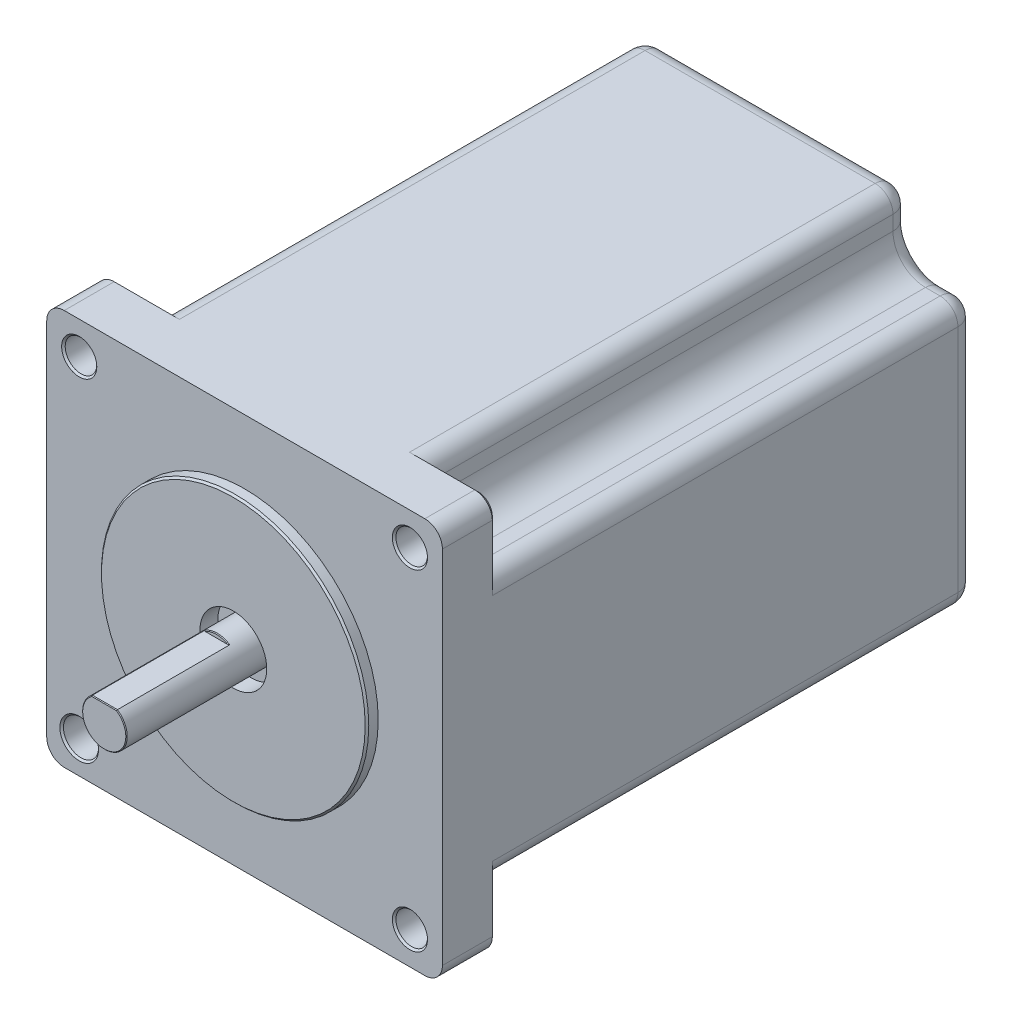
from build123d import *

# Parameters (mm, degrees)
EXTRUDE1_DEPTH      = 7.62
SKETCH2_R           = 2.25
EXTRUDE2_DEPTH      = 7.62
SKETCH3_R           = 2.25
SKETCH3_R_2         = 2.5
EXTRUDE3_DEPTH      = 7.62
SKETCH5_R           = 19.05
EXTRUDE5_DEPTH      = 9.222
EXTRUDE7_DEPTH      = 68.4
FILLET1_R           = 2.54
CHAMFER1_SIZE       = 0.508
CHAMFER2_SIZE       = 0.508
SKETCH8_R           = 5.835393935
EXTRUDE9_DEPTH      = 2.54
CHAMFER6_SIZE       = 0.254
CHAMFER7_SIZE       = 0.508
CHAMFER8_SIZE       = 0.508
SKETCH9_R           = 4.7625
CUT_EXTRUDE1_DEPTH  = 2.54
SKETCH10_R          = 3.175
BOSS_EXTRUDE1_DEPTH = 20.94
BOSS_EXTRUDE2_START = 17.538
SKETCH11_R          = 3.175
BOSS_EXTRUDE2_DEPTH = 17.538
CHAMFER9_SIZE       = 0.254
CHAMFER10_SIZE      = 0.254
CHAMFER11_SIZE      = 0.254
SKETCH12_W          = 8.536855061
SKETCH12_H          = 3.479171119
CUT_EXTRUDE2_DEPTH  = 16
CHAMFER12_SIZE      = 0.1
SKETCH13_W          = 12.128390522
SKETCH13_H          = 4.389322284
CUT_EXTRUDE3_DEPTH  = 14
CHAMFER13_SIZE      = 0.1


with BuildPart() as part:
    # Sketch1 → Extrude1 (new body)
    with BuildSketch(Plane.XY):
        with BuildLine():
            Line((25.7, -28.2), (-25.7, -28.2))
            ThreePointArc((-25.7, -28.2), (-27.467766953, -27.467766953), (-28.2, -25.7))
            Line((-28.2, -25.7), (-28.2, 25.7))
            ThreePointArc((-28.2, 25.7), (-27.467766953, 27.467766953), (-25.7, 28.2))
            Line((-25.7, 28.2), (25.7, 28.2))
            ThreePointArc((25.7, 28.2), (27.467766953, 27.467766953), (28.2, 25.7))
            Line((28.2, 25.7), (28.2, -25.7))
            ThreePointArc((28.2, -25.7), (27.467766953, -27.467766953), (25.7, -28.2))
        make_face()
    extrude(amount=EXTRUDE1_DEPTH)

    # Sketch2 → Extrude2 (cut)
    with BuildSketch(Plane.XY.offset(7.62)):
        with Locations((-23.569999999, 23.57)):
            Circle(SKETCH2_R)
    extrude(amount=-EXTRUDE2_DEPTH, mode=Mode.SUBTRACT)

    # Sketch3 → Extrude3 (cut)
    with BuildSketch(Plane.XY.offset(7.62)):
        with Locations((23.569999999, 23.57)):
            Circle(SKETCH3_R)
        with Locations((23.569999999, -23.57)):
            Circle(SKETCH3_R)
        with Locations((-23.57, -23.57)):
            Circle(SKETCH3_R_2)
    extrude(amount=-EXTRUDE3_DEPTH, mode=Mode.SUBTRACT)

    # Sketch5 → Extrude5 (add)
    with BuildSketch(Plane.XY):
        Circle(SKETCH5_R)
    extrude(amount=EXTRUDE5_DEPTH)

    # Sketch6 → Extrude7 (add)
    with BuildSketch(Plane.XY):
        with BuildLine():
            Line((-18.94, 28.2), (-18.94, 23.57))
            ThreePointArc((-18.94, 23.57), (-20.296095603, 20.296095603), (-23.57, 18.94))
            Line((-23.57, 18.94), (-28.2, 18.94))
            Line((-28.2, 18.94), (-28.2, -18.939999999))
            Line((-28.2, -18.939999999), (-23.57, -18.939999999))
            ThreePointArc((-23.57, -18.939999999), (-20.296095603, -20.296095602), (-18.94, -23.569999999))
            Line((-18.94, -23.569999999), (-18.94, -28.2))
            Line((-18.94, -28.2), (-5.065990887, -28.2))
            Line((-5.065990887, -28.2), (5.065990887, -28.2))
            Line((5.065990887, -28.2), (18.939999999, -28.2))
            Line((18.939999999, -28.2), (18.939999999, -23.569999999))
            ThreePointArc((18.939999999, -23.569999999), (20.296095602, -20.296095602), (23.569999999, -18.939999999))
            Line((23.569999999, -18.939999999), (28.2, -18.939999999))
            Line((28.2, -18.939999999), (28.2, 18.94))
            Line((28.2, 18.94), (23.57, 18.94))
            ThreePointArc((23.57, 18.94), (20.296095602, 20.296095603), (18.939999999, 23.57))
            Line((18.939999999, 23.57), (18.939999999, 28.2))
            Line((18.939999999, 28.2), (-18.94, 28.2))
        make_face()
    extrude(amount=-EXTRUDE7_DEPTH)

    # Fillet1
    fillet1_edges = [part.edges().sort_by_distance(p)[0] for p in [
        (20.296095602, 20.296095603, -68.4),
        (18.939999999, 25.885, -68.4),
        (-1e-09, 28.2, -68.4),
        (-18.94, 25.885, -68.4),
        (-20.296095603, 20.296095603, -68.4),
        (-25.885, 18.94, -68.4),
        (-28.2, 0, -68.4),
        (-25.885, -18.939999999, -68.4),
        (-20.296095603, -20.296095602, -68.4),
        (-18.94, -25.885, -68.4),
        (-1e-09, -28.2, -68.4),
        (18.939999999, -25.885, -68.4),
        (20.296095602, -20.296095602, -68.4),
        (25.885, -18.939999999, -68.4),
        (28.2, 0, -68.4),
        (25.885, 18.94, -68.4),
        (18.939999999, -28.2, -34.2),
        (28.2, -18.939999999, -34.2),
        (-18.94, -28.2, -34.2),
        (-28.2, -18.939999999, -34.2),
        (28.2, 18.94, -34.2),
        (18.939999999, 28.2, -34.2),
        (-18.94, 28.2, -34.2),
        (-28.2, 18.94, -34.2),
    ]]
    fillet(fillet1_edges, radius=FILLET1_R)

    # Chamfer1
    chamfer1_edges = [part.edges().sort_by_distance(p)[0] for p in [
        (21.049999999, 28.2, 0),
        (27.467766953, 27.467766953, 0),
        (28.2, 21.05, 0),
    ]]
    chamfer(chamfer1_edges, length=CHAMFER1_SIZE)

    # Chamfer2
    chamfer2_edges = [part.edges().sort_by_distance(p)[0] for p in [
        (-28.2, -21.049999999, 0),
        (-21.05, -28.2, 0),
        (-27.467766953, -27.467766953, 0),
    ]]
    chamfer(chamfer2_edges, length=CHAMFER2_SIZE)

    # Sketch8 → Extrude9 (cut)
    with BuildSketch(Plane(origin=(0, 0, -68.4), x_dir=(-1, 0, 0), z_dir=(0, 0, -1))):
        Circle(SKETCH8_R)
    extrude(amount=-EXTRUDE9_DEPTH, mode=Mode.SUBTRACT)

    # Chamfer6
    chamfer6_edges = [part.edges().sort_by_distance(p)[0] for p in [
        (5.835393935, 0, -68.4),
    ]]
    chamfer(chamfer6_edges, length=CHAMFER6_SIZE)

    # Chamfer7
    chamfer7_edges = [part.edges().sort_by_distance(p)[0] for p in [
        (28.2, -21.049999999, 0),
        (27.467766953, -27.467766953, 0),
        (21.049999999, -28.2, 0),
    ]]
    chamfer(chamfer7_edges, length=CHAMFER7_SIZE)

    # Chamfer8
    chamfer8_edges = [part.edges().sort_by_distance(p)[0] for p in [
        (-27.467766953, 27.467766953, 0),
        (-28.2, 21.05, 0),
        (-21.05, 28.2, 0),
    ]]
    chamfer(chamfer8_edges, length=CHAMFER8_SIZE)

    # Sketch9 → Cut-Extrude1 (cut)
    with BuildSketch(Plane.XY.offset(9.222)):
        Circle(SKETCH9_R)
    extrude(amount=-CUT_EXTRUDE1_DEPTH, mode=Mode.SUBTRACT)

    # Sketch10 → Boss-Extrude1 (add)
    with BuildSketch(Plane.XY.offset(6.682)):
        Circle(SKETCH10_R)
    extrude(amount=BOSS_EXTRUDE1_DEPTH)

    # Sketch11 → Boss-Extrude2 (add)
    with BuildSketch(Plane(origin=(0, 0, -65.86), x_dir=(-1, 0, 0), z_dir=(0, 0, -1)).offset(BOSS_EXTRUDE2_START)):
        with Locations(Location((0, 0, 0), (0, 0, 180))):
            Circle(SKETCH11_R)
    extrude(amount=-BOSS_EXTRUDE2_DEPTH)

    # Chamfer9
    chamfer9_edges = [part.edges().sort_by_distance(p)[0] for p in [
        (-19.05, 0, 9.222),
    ]]
    chamfer(chamfer9_edges, length=CHAMFER9_SIZE)

    # Chamfer10
    chamfer10_edges = [part.edges().sort_by_distance(p)[0] for p in [
        (-25.819999999, 23.57, 7.62),
        (21.319999999, 23.57, 7.62),
        (-26.07, -23.57, 7.62),
        (21.319999999, -23.57, 7.62),
    ]]
    chamfer(chamfer10_edges, length=CHAMFER10_SIZE)

    # Chamfer11
    chamfer11_edges = [part.edges().sort_by_distance(p)[0] for p in [
        (-25.819999999, 23.57, 0),
        (21.319999999, 23.57, 0),
        (-26.07, -23.57, 0),
        (21.319999999, -23.57, 0),
    ]]
    chamfer(chamfer11_edges, length=CHAMFER11_SIZE)

    # Sketch12 → Cut-Extrude2 (cut)
    with BuildSketch(Plane.XY.offset(27.622)):
        with Locations((0.361580674, 4.36458556)):
            Rectangle(SKETCH12_W, SKETCH12_H)
    extrude(amount=-CUT_EXTRUDE2_DEPTH, mode=Mode.SUBTRACT)

    # Chamfer12
    chamfer12_edges = [part.edges().sort_by_distance(p)[0] for p in [
        (-1.48490634, -2.806363868, 27.622),
        (0, 2.625, 27.622),
        (0, 3.175, 11.622),
    ]]
    chamfer(chamfer12_edges, length=CHAMFER12_SIZE)

    # Sketch13 → Cut-Extrude3 (cut)
    with BuildSketch(Plane(origin=(0, 0, -83.398), x_dir=(-1, 0, 0), z_dir=(0, 0, -1))):
        with Locations((0.157033553, 4.819661142)):
            Rectangle(SKETCH13_W, SKETCH13_H)
    extrude(amount=-CUT_EXTRUDE3_DEPTH, mode=Mode.SUBTRACT)

    # Chamfer13
    chamfer13_edges = [part.edges().sort_by_distance(p)[0] for p in [
        (-1.48490634, -2.806363868, -83.398),
        (0, 2.625, -83.398),
        (0, 3.175, -69.398),
    ]]
    chamfer(chamfer13_edges, length=CHAMFER13_SIZE)


solid = part.part
